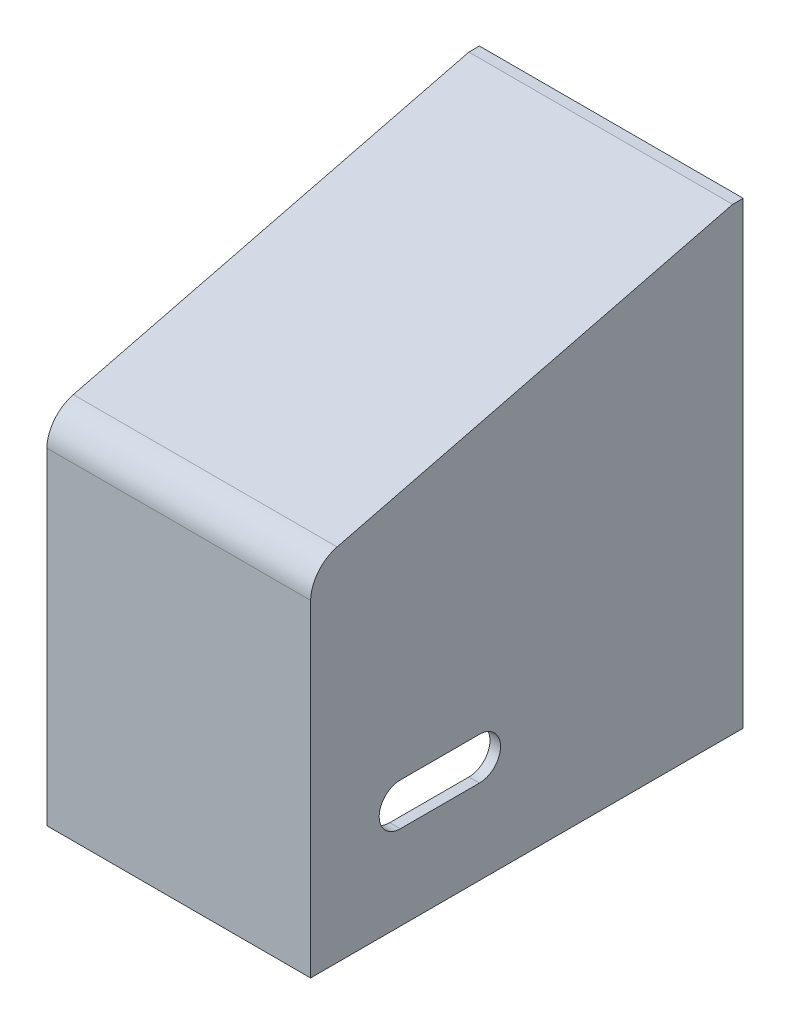
from build123d import *

# Parameters (mm, degrees)
EXTRUDE_1_DEPTH     = 2
EXTRUDE_2_DEPTH     = 2
EXTRUDE_6_DEPTH     = 50
EXTRUDE_7_DEPTH     = 2
EXTRUDE_8_DEPTH     = 2
CUT_EXTRUDE_1_DEPTH = 130.587808069
CUT_EXTRUDE_2_DEPTH = 130.587808069


with BuildPart() as part:
    # 草图3 → 凸台-拉伸1 (new body)
    with BuildSketch(Plane.XY.offset(80)):
        Polygon((-2, 0), (-2, 65), (-2, 67), (48, 67), (48, 0), align=None)
    extrude(amount=EXTRUDE_1_DEPTH)



with BuildPart() as body_2:
    # 草图2 → 凸台-拉伸2 (new body)
    with BuildSketch(Plane.XY):
        Polygon((0, 0), (0, 85), (46, 85), (46, 0), (48, 0), (48, 87), (-2, 87), (-2, 0), align=None)
    extrude(amount=EXTRUDE_2_DEPTH)


with BuildPart() as part_1:
    add(part.part)

    add(body_2.part)  # 凸台-拉伸6 merges body 2
    # 草图7 → 凸台-拉伸6 (add)
    with BuildSketch(Plane.ZY.offset(2)):
        Polygon((2, 87), (82, 67), (82, 65), (2, 85), align=None)
    extrude(amount=-EXTRUDE_6_DEPTH)

    # 草图9 → 凸台-拉伸8 (add)
    with BuildSketch(Plane(origin=(48, 0, 0), x_dir=(0, 0, -1), z_dir=(1, 0, 0))):
        Polygon((-80, 65.5), (-2, 85), (-2, 0), (-80, 0), align=None)
    extrude(amount=-EXTRUDE_8_DEPTH)

    # 草图10 → 切除-拉伸1 (cut, through all)
    with BuildSketch(Plane(origin=(48, 0, 0), x_dir=(0, 0, -1), z_dir=(1, 0, 0))):
        with BuildLine():
            Line((-82, 67), (-76.973478931, 68.256630267))
            ThreePointArc((-76.973478931, 68.256630267), (-80.539098364, 65.973770906), (-82, 62))
            Line((-82, 62), (-82, 67))
        make_face()
    extrude(amount=-CUT_EXTRUDE_1_DEPTH, mode=Mode.SUBTRACT)


with BuildPart() as body_2_2:
    # 草图8 → 凸台-拉伸7 (new body)
    with BuildSketch(Plane.ZY.offset(2)):
        Polygon((2, 85), (80, 65.5), (80, 0), (2, 0), align=None)
    extrude(amount=-EXTRUDE_7_DEPTH)


with BuildPart() as cut_extrude_2_tool:
    # 草图11 → 切除-拉伸2 (new, through all)
    with BuildSketch(Plane.ZY.offset(2)):
        with BuildLine():
            Line((50, 24), (65, 24))
            ThreePointArc((65, 24), (69, 20), (65, 16))
            Line((65, 16), (50, 16))
            ThreePointArc((50, 16), (46, 20), (50, 24))
        make_face()
    extrude(amount=-CUT_EXTRUDE_2_DEPTH)


with BuildPart() as part_2:
    add(part_1.part)

    # 切除-拉伸2: cut by cut_extrude_2_tool
    add(cut_extrude_2_tool.part, mode=Mode.SUBTRACT)


with BuildPart() as body_2_2_1:
    add(body_2_2.part)

    # 切除-拉伸2: cut by cut_extrude_2_tool
    add(cut_extrude_2_tool.part, mode=Mode.SUBTRACT)


solid = Compound([part_2.part, body_2_2_1.part])
